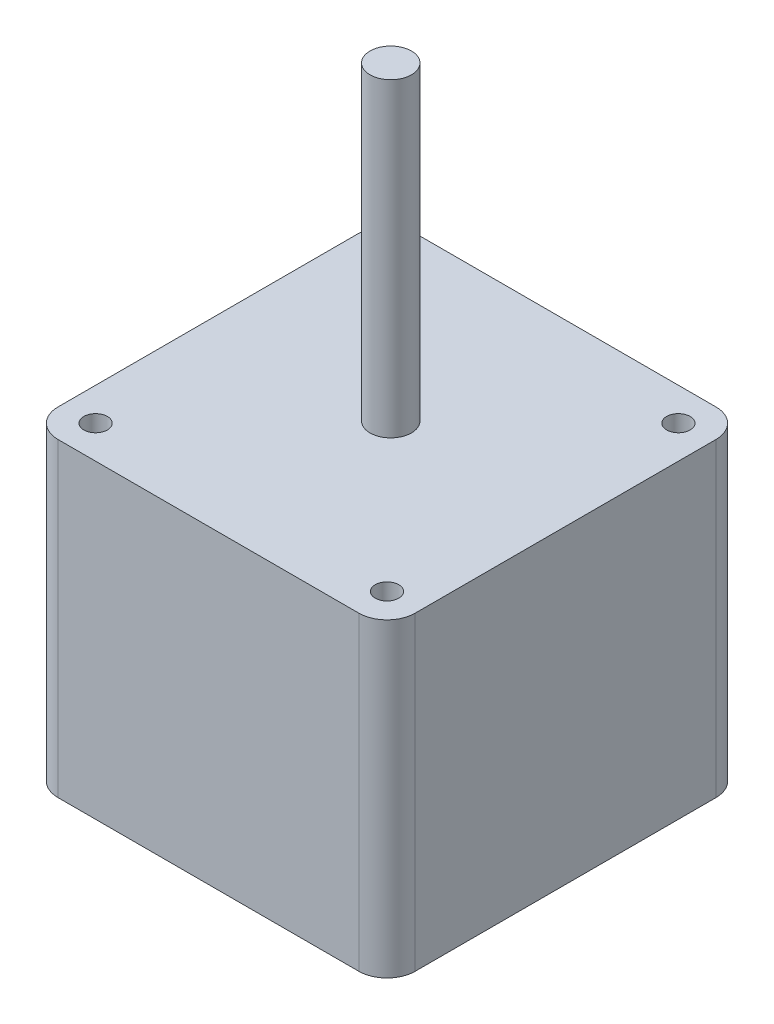
from build123d import *

# Parameters (mm, degrees)
SKETCH1_W           = 38
SKETCH1_H           = 38
BOSS_EXTRUDE1_DEPTH = 33
SKETCH2_R           = 2.2
BOSS_EXTRUDE2_DEPTH = 33
FILLET1_R           = 3
SKETCH3_R           = 1.25
CUT_EXTRUDE1_DEPTH  = 7


with BuildPart() as part:
    # Sketch1 → Boss-Extrude1 (new body)
    with BuildSketch(Plane(origin=(0, 0, 0), x_dir=(1, 0, 0), z_dir=(0, 1, 0))):
        with Locations((19, 19)):
            Rectangle(SKETCH1_W, SKETCH1_H)
    extrude(amount=BOSS_EXTRUDE1_DEPTH)

    # Sketch2 → Boss-Extrude2 (add)
    with BuildSketch(Plane(origin=(0, 33, 0), x_dir=(1, 0, 0), z_dir=(0, 1, 0))):
        with Locations(Location((19, 19.398847775, 0), (0, 0, 270))):
            Circle(SKETCH2_R)
    extrude(amount=BOSS_EXTRUDE2_DEPTH)

    # Fillet1
    fillet1_edges = [part.edges().sort_by_distance(p)[0] for p in [
        (38, 16.5, -38),
        (38, 16.5, 0),
        (0, 16.5, 0),
        (0, 16.5, -38),
    ]]
    fillet(fillet1_edges, radius=FILLET1_R)

    # Sketch3 → Cut-Extrude1 (cut)
    with BuildSketch(Plane(origin=(0, 33, 0), x_dir=(1, 0, 0), z_dir=(0, 1, 0))):
        with Locations(Location((3.5, 34.5, 0), (0, 0, 270))):
            Circle(SKETCH3_R)
        with Locations(Location((3.5, 3.5, 0), (0, 0, 270))):
            Circle(SKETCH3_R)
        with Locations(Location((34.5, 3.5, 0), (0, 0, 270))):
            Circle(SKETCH3_R)
        with Locations(Location((34.5, 34.5, 0), (0, 0, 270))):
            Circle(SKETCH3_R)
    extrude(amount=-CUT_EXTRUDE1_DEPTH, mode=Mode.SUBTRACT)


solid = part.part
